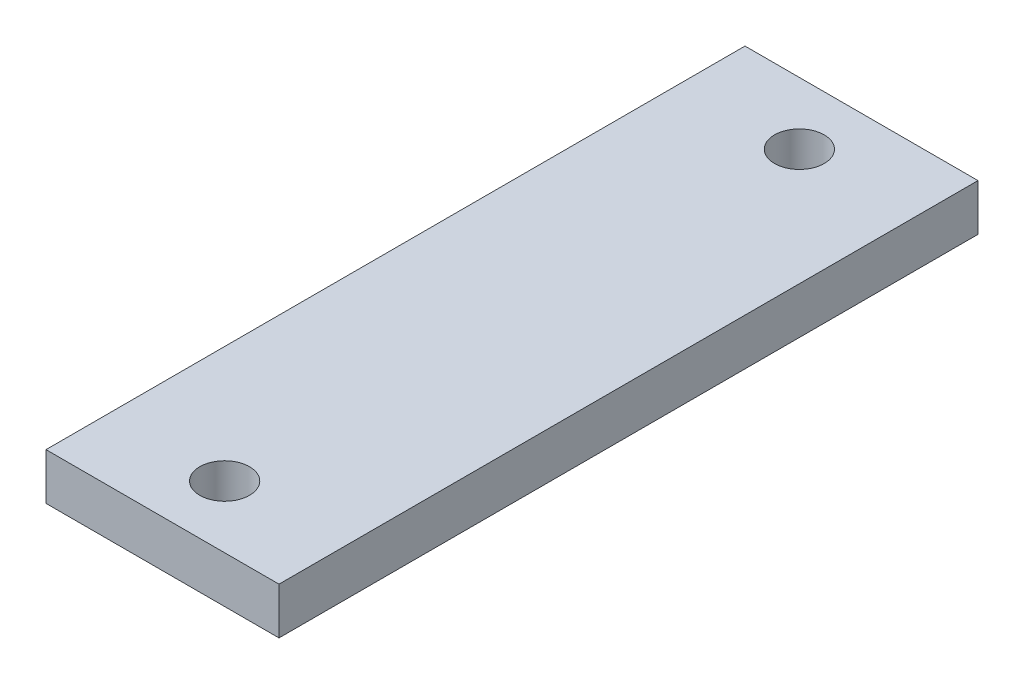
from build123d import *

# Parameters (mm, degrees)
SKETCH1_W           = 15
SKETCH1_H           = 45
BOSS_EXTRUDE1_DEPTH = 3
SKETCH2_R           = 1.6
CUT_EXTRUDE1_DEPTH  = 3


with BuildPart() as part:
    # Sketch1 → Boss-Extrude1 (new body)
    with BuildSketch(Plane(origin=(0, 0, 0), x_dir=(1, 0, 0), z_dir=(0, 1, 0))):
        with Locations((7.5, 22.5)):
            Rectangle(SKETCH1_W, SKETCH1_H)
    extrude(amount=BOSS_EXTRUDE1_DEPTH)

    # Sketch2 → Cut-Extrude1 (cut)
    with BuildSketch(Plane(origin=(0, 3, 0), x_dir=(1, 0, 0), z_dir=(0, 1, 0))):
        with Locations(Location((7.5, 4, 0), (0, 0, 270))):
            Circle(SKETCH2_R)
        with Locations(Location((7.5, 41, 0), (0, 0, 270))):
            Circle(SKETCH2_R)
    extrude(amount=-CUT_EXTRUDE1_DEPTH, mode=Mode.SUBTRACT)


solid = part.part
